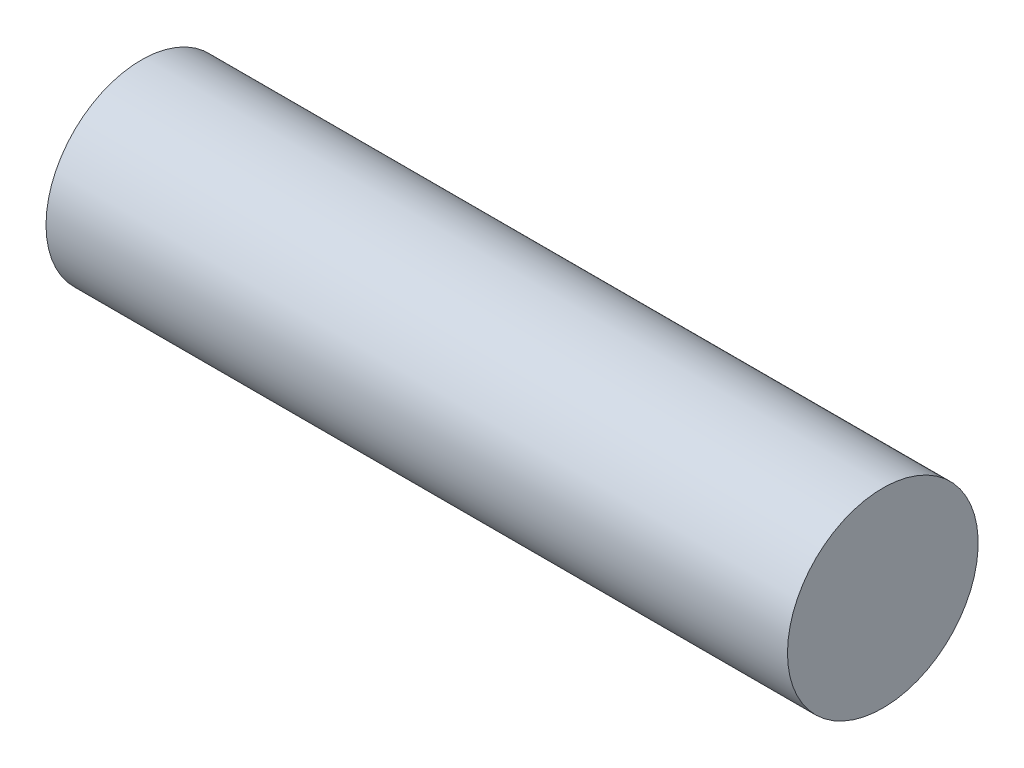
from build123d import *

# Parameters (mm, degrees)
SKETCH1_W = 70
SKETCH1_H = 9


with BuildPart() as part:
    # Sketch1 → Revolve1 (revolve)
    with BuildSketch(Plane.XY, mode=Mode.PRIVATE) as revolve1_sk:
        with Locations((-35, 4.5)):
            Rectangle(SKETCH1_W, SKETCH1_H)
    revolve(revolve1_sk.sketch.rotate(Axis((0, 0, 0), (1, 0, 0)), 90), axis=Axis((0, 0, 0), (1, 0, 0)))


solid = part.part
